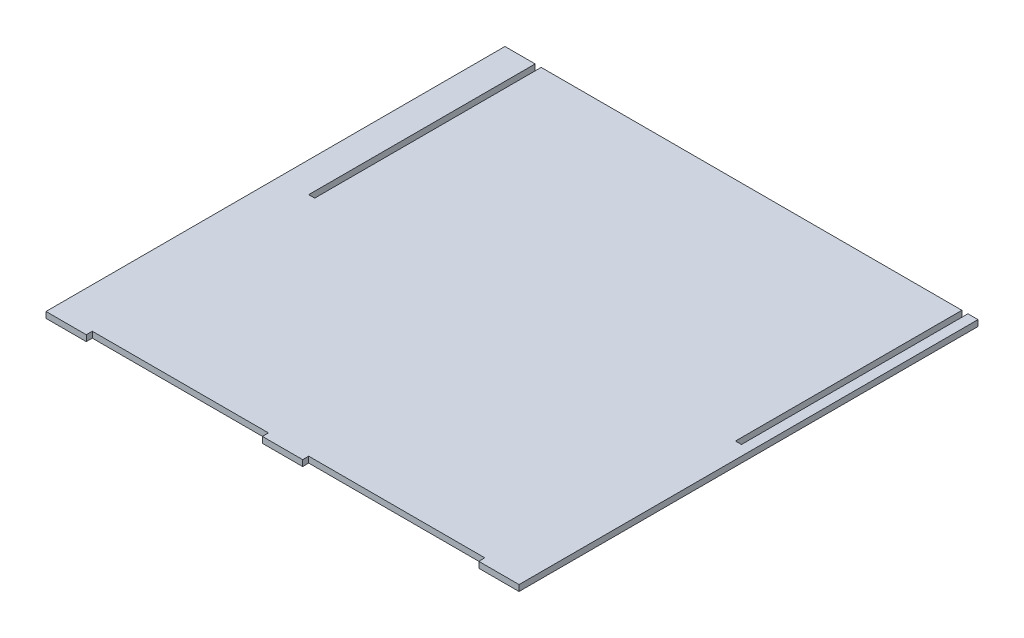
from build123d import *

# Parameters (mm, degrees)
BOSS_EXTRUDE1_DEPTH = 6
SKETCH2_W           = 6
SKETCH2_H           = 225
CUT_EXTRUDE1_DEPTH  = 6
LPATTERN1_COUNT     = 2
LPATTERN1_PITCH     = 424


with BuildPart() as part:
    # Sketch1 → Boss-Extrude1 (new body)
    with BuildSketch(Plane(origin=(0, 0, 0), x_dir=(1, 0, 0), z_dir=(0, 1, 0))):
        Polygon((-470, 0), (-430, 0), (-430, 6), (-255, 6), (-255, 0), (-215, 0), (-215, 6), (-40, 6), (-40, 0), (0, 0), (0, 456), (-470, 456), align=None)
    extrude(amount=BOSS_EXTRUDE1_DEPTH)

    # Sketch2 → Cut-Extrude1 (cut)
    with BuildSketch(Plane(origin=(0, 6, 0), x_dir=(1, 0, 0), z_dir=(0, 1, 0))):
        with Locations((-13, 343.5)):
            Rectangle(SKETCH2_W, SKETCH2_H)
    cut_extrude1 = extrude(amount=-CUT_EXTRUDE1_DEPTH, mode=Mode.SUBTRACT)

    # LPattern1: Cut-Extrude1 ×2
    with Locations(*[(-i * LPATTERN1_PITCH, 0, 0) for i in range(1, LPATTERN1_COUNT)]):
        add(cut_extrude1, mode=Mode.SUBTRACT)


solid = part.part
